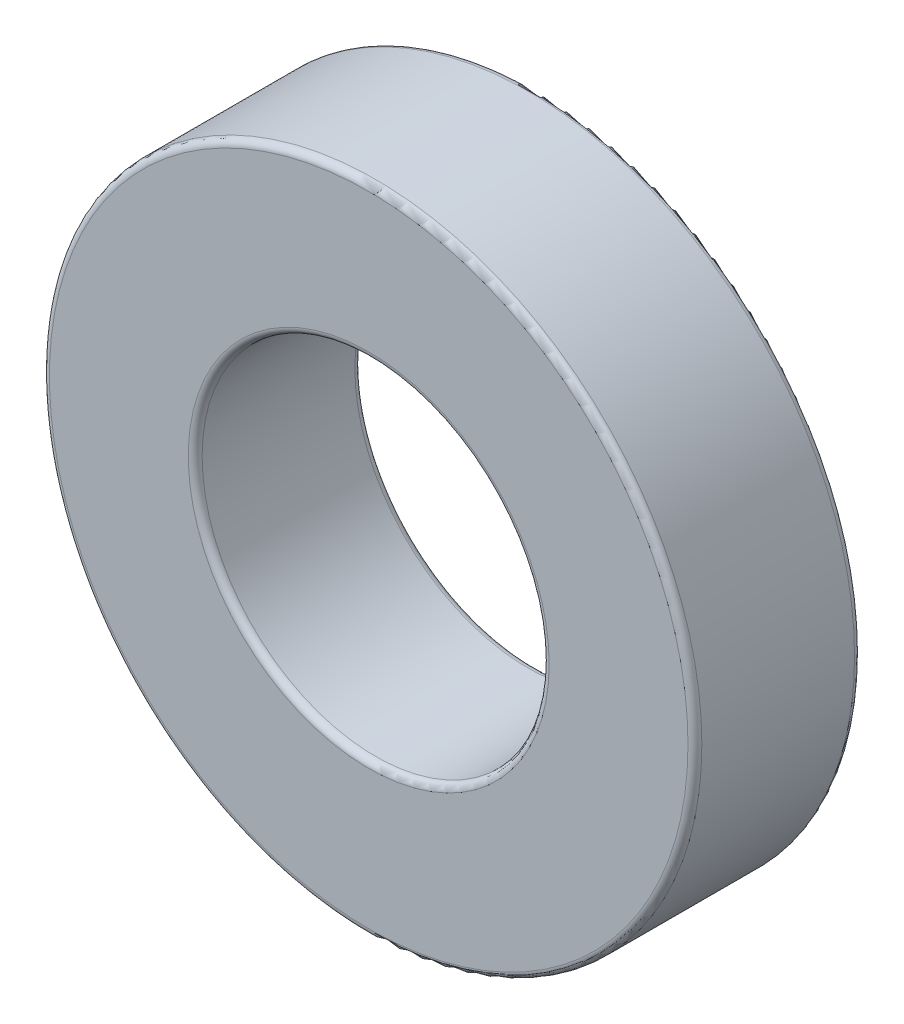
from build123d import *

# Parameters (mm, degrees)
SKETCH1_R           = 23.5
SKETCH1_R_2         = 12.5
BOSS_EXTRUDE1_DEPTH = 12
FILLET1_R           = 0.5


with BuildPart() as part:
    # Sketch1 → Boss-Extrude1 (new body)
    with BuildSketch(Plane.XY):
        Circle(SKETCH1_R)
        Circle(SKETCH1_R_2, mode=Mode.SUBTRACT)
    extrude(amount=BOSS_EXTRUDE1_DEPTH)

    # Fillet1
    fillet1_edges = [part.edges().sort_by_distance(p)[0] for p in [
        (-23.5, 0, 0),
        (-23.5, 0, 12),
        (-12.5, 0, 0),
        (-12.5, 0, 12),
    ]]
    fillet(fillet1_edges, radius=FILLET1_R)


solid = part.part
